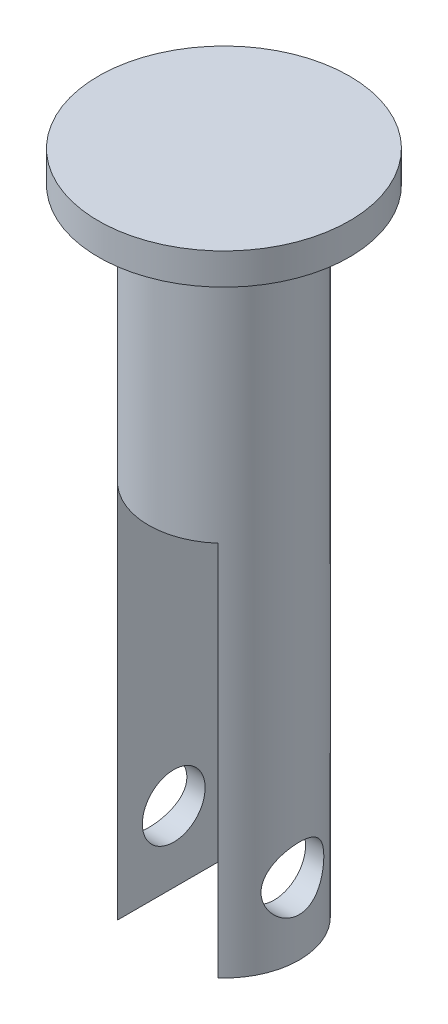
from build123d import *

# Parameters (mm, degrees)
SKETCH_4_W          = 16
SKETCH_4_H          = 70
CUT_EXTRUDE_1_DEPTH = 15
SKETCH_6_R          = 5
CUT_EXTRUDE_2_DEPTH = 15


with BuildPart() as part:
    # 草图1 → 旋转1 (revolve)
    with BuildSketch(Plane.XY, mode=Mode.PRIVATE) as revolve_1_sk:
        Polygon((-0.455930312, 112.0664832), (19.544069688, 112.0664832), (19.544069688, 107.0664832), (11.544069688, 107.0664832), (11.544069688, 6.0664832), (-0.455930312, 6.0664832), align=None)
    revolve(revolve_1_sk.sketch.rotate(Axis((-0.455930312, 6.0664832, 0), (0, 1, 0)), 90), axis=Axis((-0.455930312, 6.0664832, 0), (0, 1, 0)))

    # 草图4 → 切除-拉伸1 (cut, symmetric)
    with BuildSketch(Plane.XY):
        with Locations((-0.455930312, 31.0664832)):
            Rectangle(SKETCH_4_W, SKETCH_4_H)
    extrude(amount=CUT_EXTRUDE_1_DEPTH, both=True, mode=Mode.SUBTRACT)

    # 草图6 → 切除-拉伸2 (cut, symmetric)
    with BuildSketch(Plane(origin=(0, 0, 0), x_dir=(0, 0, -1), z_dir=(1, 0, 0))):
        with Locations((0, 17.347075097)):
            Circle(SKETCH_6_R)
    extrude(amount=CUT_EXTRUDE_2_DEPTH, both=True, mode=Mode.SUBTRACT)


solid = part.part
